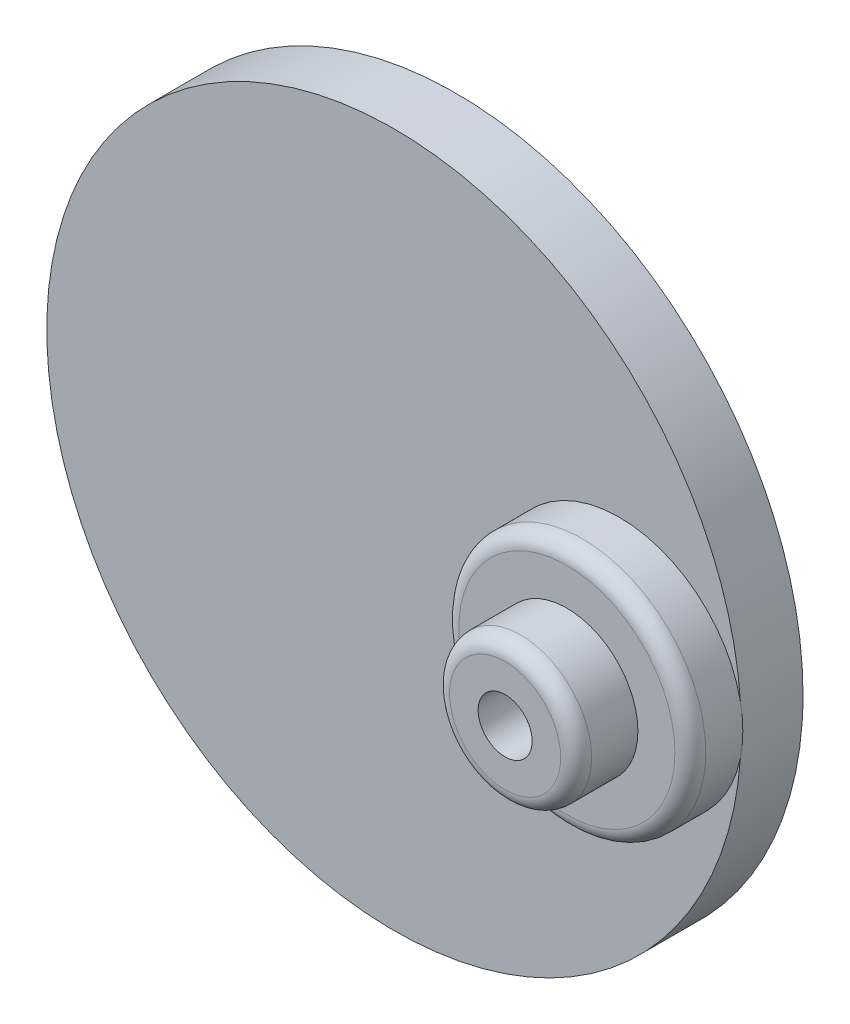
from build123d import *

# Parameters (mm, degrees)
ESQUISSE1_R                  = 11.25
BOSS_EXTRU_1_DEPTH           = 2
ESQUISSE2_R                  = 4
BOSS_EXTRU_2_DEPTH           = 1.7
ESQUISSE3_R                  = 2.3
BOSS_EXTRU_3_DEPTH           = 2
CONG_1_R                     = 0.5
ESQUISSE4_R                  = 3
BOSS_EXTRU_4_DEPTH           = 4
ESQUISSE5_R                  = 1.45
ENL_V_MAT_EXTRU_1_DEPTH      = 2
TROU_TARAUD_M2_2X0_451_D     = 1.75
TROU_TARAUD_M2_2X0_451_DEPTH = 5
TROU_TARAUD_M2_2X0_451_TIP   = 0.525753042
CONG_2_R                     = 0.2


with BuildPart() as part:
    # Esquisse1 → Boss.-Extru.1 (new body)
    with BuildSketch(Plane.XY):
        Circle(ESQUISSE1_R)
    extrude(amount=BOSS_EXTRU_1_DEPTH)

    # Esquisse2 → Boss.-Extru.2 (add)
    with BuildSketch(Plane.XY.offset(2)):
        with Locations(Location((7.3, 0, 0), (0, 0, 348.723074946))):
            Circle(ESQUISSE2_R)
    extrude(amount=BOSS_EXTRU_2_DEPTH)

    # Esquisse3 → Boss.-Extru.3 (add)
    with BuildSketch(Plane.XY.offset(3.7)):
        with Locations((7.3, 0)):
            Circle(ESQUISSE3_R)
    extrude(amount=BOSS_EXTRU_3_DEPTH)

    # Congé1
    cong_1_edges = [part.edges().sort_by_distance(p)[0] for p in [
        (5, 0, 5.7),
        (3.377226027, 0.782204807, 3.7),
    ]]
    fillet(cong_1_edges, radius=CONG_1_R)

    # Esquisse4 → Boss.-Extru.4 (add)
    with BuildSketch(Plane(origin=(0, 0, 0), x_dir=(-1, 0, 0), z_dir=(0, 0, -1))):
        Circle(ESQUISSE4_R)
    extrude(amount=BOSS_EXTRU_4_DEPTH)

    # Esquisse5 → Enlèv. mat.-Extru.1 (cut)
    with BuildSketch(Plane(origin=(0, 0, -4), x_dir=(-1, 0, 0), z_dir=(0, 0, -1))):
        Circle(ESQUISSE5_R)
    extrude(amount=-ENL_V_MAT_EXTRU_1_DEPTH, mode=Mode.SUBTRACT)

    # Trou taraudé M2.2x0.451
    with Locations(Plane.XY.offset(5.7)):
        with Locations((7.3, 0)):
            Hole(TROU_TARAUD_M2_2X0_451_D / 2, depth=TROU_TARAUD_M2_2X0_451_DEPTH)
            with Locations((0, 0, -(TROU_TARAUD_M2_2X0_451_DEPTH + TROU_TARAUD_M2_2X0_451_TIP / 2))):  # 118° drill point
                Cone(0, TROU_TARAUD_M2_2X0_451_D / 2, TROU_TARAUD_M2_2X0_451_TIP, mode=Mode.SUBTRACT)

    # Congé2
    cong_2_edges = [part.edges().sort_by_distance(p)[0] for p in [
        (3, 0, -4),
    ]]
    fillet(cong_2_edges, radius=CONG_2_R)


solid = part.part
